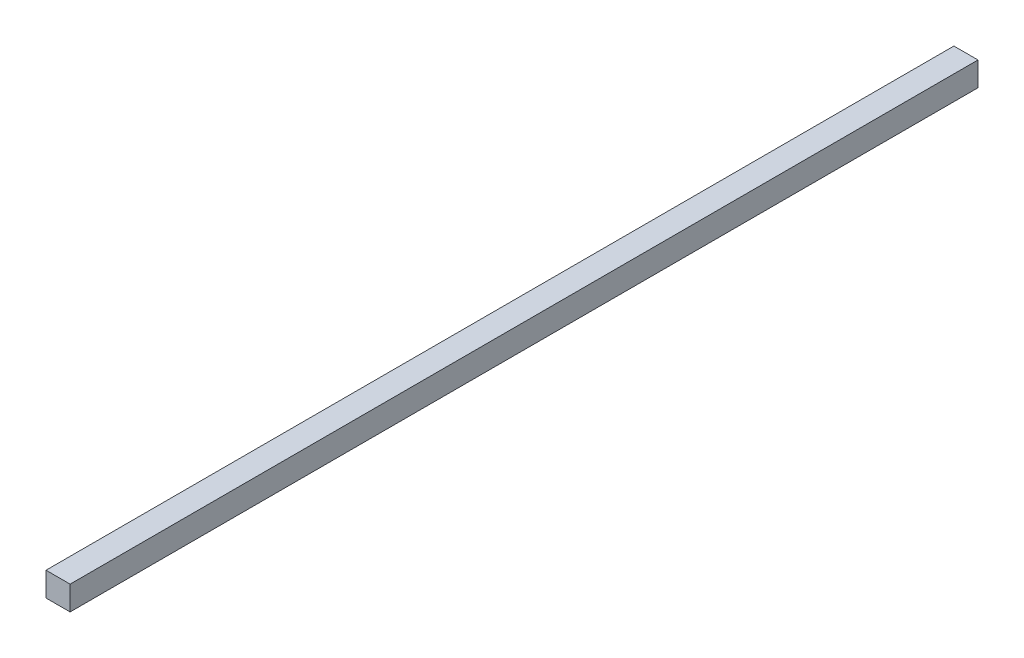
from build123d import *

# Parameters (mm, degrees)
SKETCH1_W           = 452
SKETCH1_H           = 12
BOSS_EXTRUDE1_DEPTH = 12


with BuildPart() as part:
    # Sketch1 → Boss-Extrude1 (new body)
    with BuildSketch(Plane(origin=(0, 0, 0), x_dir=(0, 0, -1), z_dir=(1, 0, 0))):
        with Locations((226, 6)):
            Rectangle(SKETCH1_W, SKETCH1_H)
    extrude(amount=BOSS_EXTRUDE1_DEPTH)


solid = part.part
